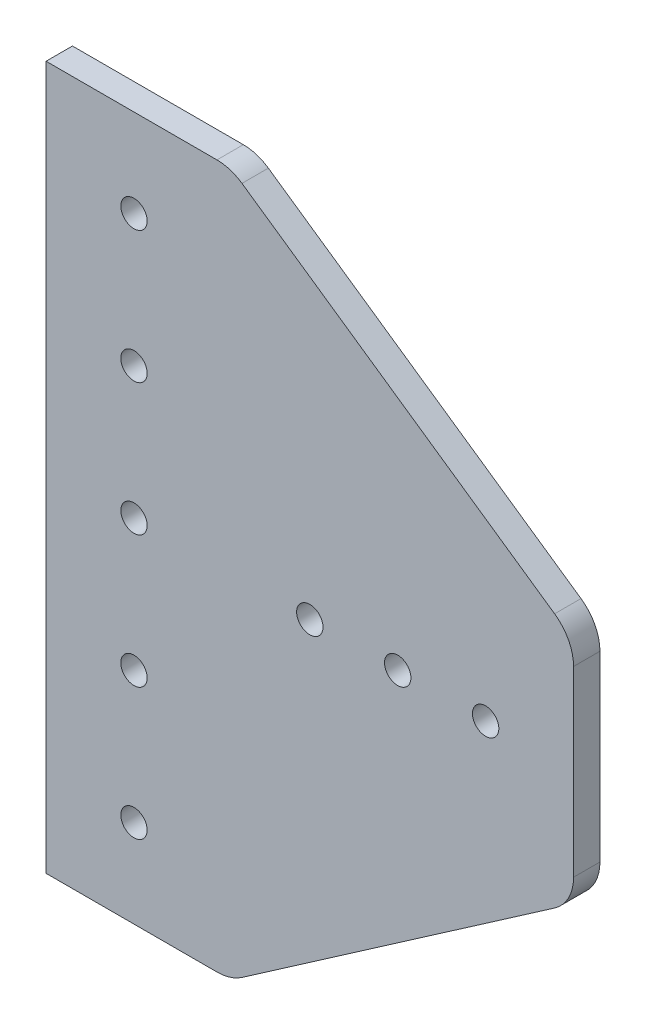
from build123d import *

# Parameters (mm, degrees)
SKETCH_1_R      = 1.5
EXTRUDE_1_DEPTH = 1.5
FILLET_1_R      = 5


with BuildPart() as part:
    # 草图1 → 凸台-拉伸1 (new, symmetric)
    with BuildSketch(Plane.XY):
        Polygon((0, 40), (0, -40), (21, -40), (60, -13), (60, 13), (21, 40), align=None)
        with Locations((10, 0)):
            Circle(SKETCH_1_R, mode=Mode.SUBTRACT)
        with Locations((10, 15)):
            Circle(SKETCH_1_R, mode=Mode.SUBTRACT)
        with Locations((10, 30)):
            Circle(SKETCH_1_R, mode=Mode.SUBTRACT)
        with Locations(Location((10, -15, 0), (0, 0, 180))):
            Circle(SKETCH_1_R, mode=Mode.SUBTRACT)
        with Locations(Location((10, -30, 0), (0, 0, 180))):
            Circle(SKETCH_1_R, mode=Mode.SUBTRACT)
        with Locations((30, 0)):
            Circle(SKETCH_1_R, mode=Mode.SUBTRACT)
        with Locations((40, 0)):
            Circle(SKETCH_1_R, mode=Mode.SUBTRACT)
        with Locations((50, 0)):
            Circle(SKETCH_1_R, mode=Mode.SUBTRACT)
    extrude(amount=EXTRUDE_1_DEPTH, both=True)

    # 圆角1
    fillet_1_edges = [part.edges().sort_by_distance(p)[0] for p in [
        (60, 13, 0),
        (60, -13, 0),
        (21, -40, 0),
        (21, 40, 0),
    ]]
    fillet(fillet_1_edges, radius=FILLET_1_R)


solid = part.part
